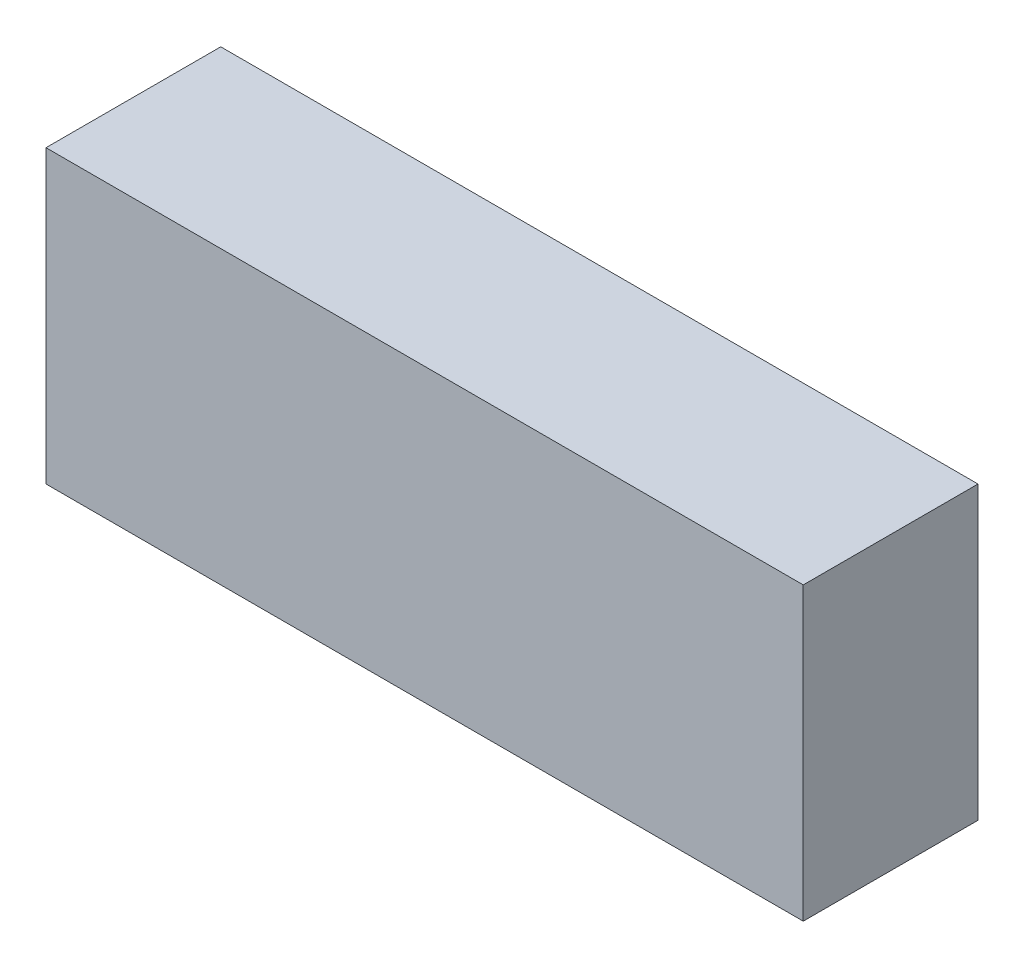
from build123d import *

# Parameters (mm, degrees)
SKETCH1_W           = 13
SKETCH1_H           = 5
BOSS_EXTRUDE1_DEPTH = 3


with BuildPart() as part:
    # Sketch1 → Boss-Extrude1 (new body)
    with BuildSketch(Plane.XY):
        with Locations((6.5, 2.5)):
            Rectangle(SKETCH1_W, SKETCH1_H)
    extrude(amount=BOSS_EXTRUDE1_DEPTH)


solid = part.part
